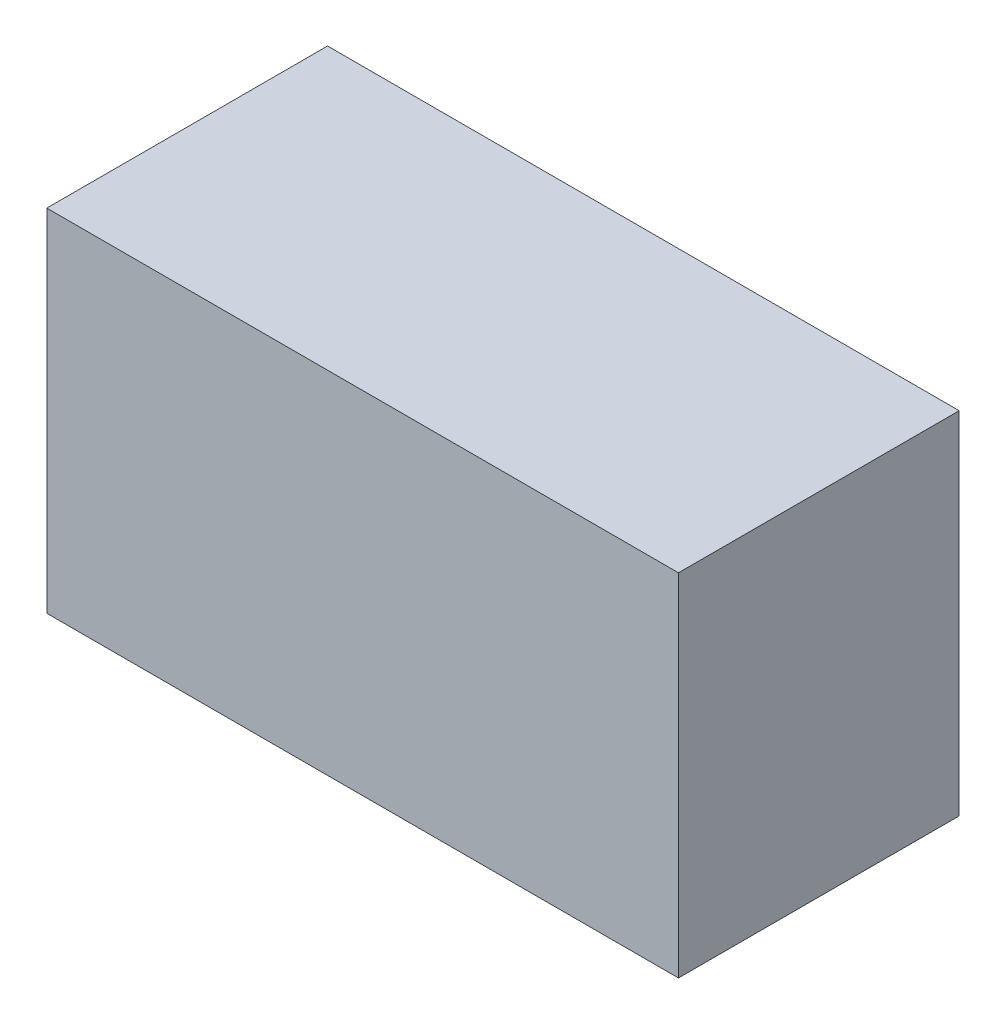
from build123d import *

# Parameters (mm, degrees)
SKETCH1_W           = 45
SKETCH1_H           = 20
BOSS_EXTRUDE1_DEPTH = 25


with BuildPart() as part:
    # Sketch1 → Boss-Extrude1 (new body)
    with BuildSketch(Plane(origin=(0, 0, 0), x_dir=(1, 0, 0), z_dir=(0, 1, 0))):
        Rectangle(SKETCH1_W, SKETCH1_H)
    extrude(amount=BOSS_EXTRUDE1_DEPTH)


solid = part.part
